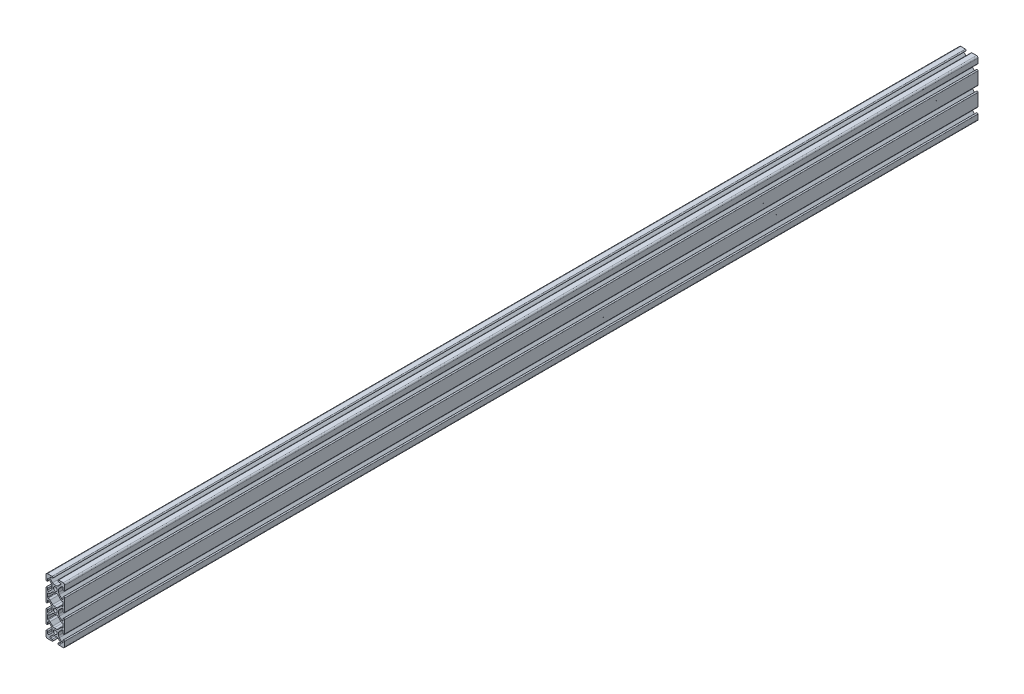
from build123d import *

# Parameters (mm, degrees)
SKETCH1_R      = 2.5
EXTRUDE1_DEPTH = 1219.2


with BuildPart() as part:
    # Sketch1 → Extrude1 (new body)
    with BuildSketch(Plane.XY):
        with BuildLine():
            Line((10.359994631, 56.429997403), (10.359989144, 54.32))
            ThreePointArc((10.359989144, 54.32), (11.429994572, 53.249994572), (12.5, 54.32))
            Line((12.5, 54.32), (12.5, 60.5))
            ThreePointArc((12.5, 60.5), (11.914213562, 61.914213562), (10.5, 62.5))
            Line((10.5, 62.5), (4.32, 62.5))
            ThreePointArc((4.32, 62.5), (3.25, 61.429994572), (4.32, 60.359989144))
            Line((4.32, 60.359989144), (6.429506446, 60.359994631))
            ThreePointArc((6.429506446, 60.359994631), (7.35320663, 59.743115807), (7.139431986, 58.653133278))
            Line((7.139431986, 58.653133278), (3.790027931, 55.303236443))
            ThreePointArc((3.790027931, 55.303236443), (2.761605915, 54.616066821), (1.548499435, 54.374764939))
            Line((1.548499435, 54.374764939), (-1.548499435, 54.374764939))
            ThreePointArc((-1.548499435, 54.374764939), (-2.761605915, 54.616066821), (-3.790027931, 55.303236443))
            Line((-3.790027931, 55.303236443), (-7.138393059, 58.651601571))
            ThreePointArc((-7.138393059, 58.651601571), (-7.354112119, 59.742117633), (-6.429997403, 60.359994631))
            Line((-6.429997403, 60.359994631), (-4.32, 60.359989144))
            ThreePointArc((-4.32, 60.359989144), (-3.25, 61.429994572), (-4.32, 62.5))
            Line((-4.32, 62.5), (-10.5, 62.5))
            ThreePointArc((-10.5, 62.5), (-11.914213562, 61.914213562), (-12.5, 60.5))
            Line((-12.5, 60.5), (-12.5, 54.32))
            ThreePointArc((-12.5, 54.32), (-11.429994572, 53.25), (-10.359989144, 54.32))
            Line((-10.359989144, 54.32), (-10.359994631, 56.429506446))
            ThreePointArc((-10.359994631, 56.429506446), (-9.743115807, 57.35320663), (-8.653133278, 57.139431986))
            Line((-8.653133278, 57.139431986), (-5.303236443, 53.790027931))
            ThreePointArc((-5.303236443, 53.790027931), (-4.616066821, 52.761605915), (-4.374764939, 51.548499435))
            Line((-4.374764939, 51.548499435), (-4.374764939, 48.451500565))
            ThreePointArc((-4.374764939, 48.451500565), (-4.616066821, 47.238394085), (-5.303236443, 46.209972069))
            Line((-5.303236443, 46.209972069), (-8.651601571, 42.861606941))
            ThreePointArc((-8.651601571, 42.861606941), (-9.742117633, 42.645887881), (-10.359994631, 43.570002597))
            Line((-10.359994631, 43.570002597), (-10.359989144, 45.68))
            ThreePointArc((-10.359989144, 45.68), (-11.429994572, 46.75), (-12.5, 45.68))
            Line((-12.5, 45.68), (-12.5, 29.32))
            ThreePointArc((-12.5, 29.32), (-11.429994572, 28.25), (-10.359989144, 29.32))
            Line((-10.359989144, 29.32), (-10.359994631, 31.429506446))
            ThreePointArc((-10.359994631, 31.429506446), (-9.743115807, 32.35320663), (-8.653133278, 32.139431986))
            Line((-8.653133278, 32.139431986), (-5.303236443, 28.790027931))
            ThreePointArc((-5.303236443, 28.790027931), (-4.616066821, 27.761605915), (-4.374764939, 26.548499435))
            Line((-4.374764939, 26.548499435), (-4.374764939, 23.451500565))
            ThreePointArc((-4.374764939, 23.451500565), (-4.616066821, 22.238394085), (-5.303236443, 21.209972069))
            Line((-5.303236443, 21.209972069), (-8.651601571, 17.861606941))
            ThreePointArc((-8.651601571, 17.861606941), (-9.742117633, 17.645887881), (-10.359994631, 18.570002597))
            Line((-10.359994631, 18.570002597), (-10.359989144, 20.68))
            ThreePointArc((-10.359989144, 20.68), (-11.429994572, 21.75), (-12.5, 20.68))
            Line((-12.5, 20.68), (-12.5, 4.32))
            ThreePointArc((-12.5, 4.32), (-11.429994572, 3.25), (-10.359989144, 4.32))
            Line((-10.359989144, 4.32), (-10.359994631, 6.429506446))
            ThreePointArc((-10.359994631, 6.429506446), (-9.743115807, 7.35320663), (-8.653133278, 7.139431986))
            Line((-8.653133278, 7.139431986), (-5.303236443, 3.790027931))
            ThreePointArc((-5.303236443, 3.790027931), (-4.616066821, 2.761605915), (-4.374764939, 1.548499435))
            Line((-4.374764939, 1.548499435), (-4.374764939, -1.548499435))
            ThreePointArc((-4.374764939, -1.548499435), (-4.616066821, -2.761605915), (-5.303236443, -3.790027931))
            Line((-5.303236443, -3.790027931), (-8.651601571, -7.138393059))
            ThreePointArc((-8.651601571, -7.138393059), (-9.742114506, -7.354113415), (-10.359994624, -6.430004173))
            Line((-10.359994624, -6.430004173), (-10.359989144, -4.32))
            ThreePointArc((-10.359989144, -4.32), (-11.429994572, -3.25), (-12.5, -4.32))
            Line((-12.5, -4.32), (-12.5, -10.5))
            ThreePointArc((-12.5, -10.5), (-11.914213562, -11.914213562), (-10.5, -12.5))
            Line((-10.5, -12.5), (-4.32, -12.5))
            ThreePointArc((-4.32, -12.5), (-3.25, -11.429994572), (-4.32, -10.359989144))
            Line((-4.32, -10.359989144), (-6.429506446, -10.359994631))
            ThreePointArc((-6.429506446, -10.359994631), (-7.35320663, -9.743115807), (-7.139431986, -8.653133278))
            Line((-7.139431986, -8.653133278), (-3.790027931, -5.303236443))
            ThreePointArc((-3.790027931, -5.303236443), (-2.761605915, -4.616066821), (-1.548499435, -4.374764939))
            Line((-1.548499435, -4.374764939), (1.548499435, -4.374764939))
            ThreePointArc((1.548499435, -4.374764939), (2.761605915, -4.616066821), (3.790027931, -5.303236443))
            Line((3.790027931, -5.303236443), (7.138393059, -8.651601571))
            ThreePointArc((7.138393059, -8.651601571), (7.354112119, -9.742117633), (6.429997403, -10.359994631))
            Line((6.429997403, -10.359994631), (4.32, -10.359989144))
            ThreePointArc((4.32, -10.359989144), (3.25, -11.429994572), (4.32, -12.5))
            Line((4.32, -12.5), (10.5, -12.5))
            ThreePointArc((10.5, -12.5), (11.914213562, -11.914213562), (12.5, -10.5))
            Line((12.5, -10.5), (12.5, -4.32))
            ThreePointArc((12.5, -4.32), (11.429994572, -3.25), (10.359989144, -4.32))
            Line((10.359989144, -4.32), (10.359994631, -6.429506446))
            ThreePointArc((10.359994631, -6.429506446), (9.743115807, -7.35320663), (8.653133278, -7.139431986))
            Line((8.653133278, -7.139431986), (5.303236443, -3.790027931))
            ThreePointArc((5.303236443, -3.790027931), (4.616066821, -2.761605915), (4.374764939, -1.548499435))
            Line((4.374764939, -1.548499435), (4.374764939, 1.548499435))
            ThreePointArc((4.374764939, 1.548499435), (4.616066821, 2.761605915), (5.303236443, 3.790027931))
            Line((5.303236443, 3.790027931), (8.651601571, 7.138393059))
            ThreePointArc((8.651601571, 7.138393059), (9.742064275, 7.354134242), (10.359994624, 6.430113002))
            Line((10.359994624, 6.430113002), (10.359989144, 4.32))
            ThreePointArc((10.359989144, 4.32), (11.429994572, 3.25), (12.5, 4.32))
            Line((12.5, 4.32), (12.5, 20.68))
            ThreePointArc((12.5, 20.68), (11.429994572, 21.75), (10.359989144, 20.68))
            Line((10.359989144, 20.68), (10.359994631, 18.570493554))
            ThreePointArc((10.359994631, 18.570493554), (9.743115807, 17.64679337), (8.653133278, 17.860568014))
            Line((8.653133278, 17.860568014), (5.303236443, 21.209972069))
            ThreePointArc((5.303236443, 21.209972069), (4.616066821, 22.238394085), (4.374764939, 23.451500565))
            Line((4.374764939, 23.451500565), (4.374764939, 26.548499435))
            ThreePointArc((4.374764939, 26.548499435), (4.616066821, 27.761605915), (5.303236443, 28.790027931))
            Line((5.303236443, 28.790027931), (8.651601571, 32.138393059))
            ThreePointArc((8.651601571, 32.138393059), (9.742117633, 32.354112119), (10.359994631, 31.429997403))
            Line((10.359994631, 31.429997403), (10.359989144, 29.32))
            ThreePointArc((10.359989144, 29.32), (11.429994572, 28.25), (12.5, 29.32))
            Line((12.5, 29.32), (12.5, 45.68))
            ThreePointArc((12.5, 45.68), (11.429994572, 46.75), (10.359989144, 45.68))
            Line((10.359989144, 45.68), (10.359994631, 43.570493554))
            ThreePointArc((10.359994631, 43.570493554), (9.743115807, 42.64679337), (8.653133278, 42.860568014))
            Line((8.653133278, 42.860568014), (5.303236443, 46.209972069))
            ThreePointArc((5.303236443, 46.209972069), (4.616066821, 47.238394085), (4.374764939, 48.451500565))
            Line((4.374764939, 48.451500565), (4.374764939, 51.548499435))
            ThreePointArc((4.374764939, 51.548499435), (4.616066821, 52.761605915), (5.303236443, 53.790027931))
            Line((5.303236443, 53.790027931), (8.651601571, 57.138393059))
            ThreePointArc((8.651601571, 57.138393059), (9.742117633, 57.354112119), (10.359994631, 56.429997403))
        make_face()
        Circle(SKETCH1_R, mode=Mode.SUBTRACT)
        with Locations((0, 25)):
            Circle(SKETCH1_R, mode=Mode.SUBTRACT)
        with Locations((0, 50)):
            Circle(SKETCH1_R, mode=Mode.SUBTRACT)
        with BuildLine():
            Line((9.369848481, 15.43), (9.6, 15.43))
            ThreePointArc((9.6, 15.43), (10.137401154, 15.207401154), (10.36, 14.67))
            Line((10.36, 14.67), (10.36, 10.330489657))
            ThreePointArc((10.36, 10.330489657), (10.137401154, 9.793088504), (9.6, 9.570489657))
            Line((9.6, 9.570489657), (9.369847005, 9.570489657))
            ThreePointArc((9.369847005, 9.570489657), (8.156632812, 9.329143157), (7.128153634, 8.641853267))
            Line((7.128153634, 8.641853267), (3.790027931, 5.303236443))
            ThreePointArc((3.790027931, 5.303236443), (2.761605915, 4.616066821), (1.548499435, 4.374764939))
            Line((1.548499435, 4.374764939), (-1.548499435, 4.374764939))
            ThreePointArc((-1.548499435, 4.374764939), (-2.761605915, 4.616066821), (-3.790027931, 5.303236443))
            Line((-3.790027931, 5.303236443), (-7.128319985, 8.641528496))
            ThreePointArc((-7.128319985, 8.641528496), (-8.156742, 9.328698118), (-9.369848481, 9.57))
            Line((-9.369848481, 9.57), (-9.6, 9.57))
            ThreePointArc((-9.6, 9.57), (-10.137401154, 9.792598846), (-10.36, 10.33))
            Line((-10.36, 10.33), (-10.36, 14.669510343))
            ThreePointArc((-10.36, 14.669510343), (-10.137401154, 15.206911496), (-9.6, 15.429510343))
            Line((-9.6, 15.429510343), (-9.369847005, 15.429510343))
            ThreePointArc((-9.369847005, 15.429510343), (-8.156632812, 15.670856843), (-7.128153634, 16.358146733))
            Line((-7.128153634, 16.358146733), (-3.790027931, 19.696763557))
            ThreePointArc((-3.790027931, 19.696763557), (-2.761605915, 20.383933179), (-1.548499435, 20.625235061))
            Line((-1.548499435, 20.625235061), (1.548499435, 20.625235061))
            ThreePointArc((1.548499435, 20.625235061), (2.761605915, 20.383933179), (3.790027931, 19.696763557))
            Line((3.790027931, 19.696763557), (7.128319985, 16.358471504))
            ThreePointArc((7.128319985, 16.358471504), (8.156742, 15.671301882), (9.369848481, 15.43))
        make_face(mode=Mode.SUBTRACT)
        with BuildLine():
            Line((9.369848481, 40.43), (9.6, 40.43))
            ThreePointArc((9.6, 40.43), (10.137401154, 40.207401154), (10.36, 39.67))
            Line((10.36, 39.67), (10.36, 35.330489657))
            ThreePointArc((10.36, 35.330489657), (10.137401154, 34.793088504), (9.6, 34.570489657))
            Line((9.6, 34.570489657), (9.369847005, 34.570489657))
            ThreePointArc((9.369847005, 34.570489657), (8.156632812, 34.329143157), (7.128153634, 33.641853267))
            Line((7.128153634, 33.641853267), (3.790027931, 30.303236443))
            ThreePointArc((3.790027931, 30.303236443), (2.761605915, 29.616066821), (1.548499435, 29.374764939))
            Line((1.548499435, 29.374764939), (-1.548499435, 29.374764939))
            ThreePointArc((-1.548499435, 29.374764939), (-2.761605915, 29.616066821), (-3.790027931, 30.303236443))
            Line((-3.790027931, 30.303236443), (-7.128319985, 33.641528496))
            ThreePointArc((-7.128319985, 33.641528496), (-8.156742, 34.328698118), (-9.369848481, 34.57))
            Line((-9.369848481, 34.57), (-9.6, 34.57))
            ThreePointArc((-9.6, 34.57), (-10.137401154, 34.792598846), (-10.36, 35.33))
            Line((-10.36, 35.33), (-10.36, 39.669510343))
            ThreePointArc((-10.36, 39.669510343), (-10.137401154, 40.206911496), (-9.6, 40.429510343))
            Line((-9.6, 40.429510343), (-9.369847005, 40.429510343))
            ThreePointArc((-9.369847005, 40.429510343), (-8.156632812, 40.670856843), (-7.128153634, 41.358146733))
            Line((-7.128153634, 41.358146733), (-3.790027931, 44.696763557))
            ThreePointArc((-3.790027931, 44.696763557), (-2.761605915, 45.383933179), (-1.548499435, 45.625235061))
            Line((-1.548499435, 45.625235061), (1.548499435, 45.625235061))
            ThreePointArc((1.548499435, 45.625235061), (2.761605915, 45.383933179), (3.790027931, 44.696763557))
            Line((3.790027931, 44.696763557), (7.128319985, 41.358471504))
            ThreePointArc((7.128319985, 41.358471504), (8.156742, 40.671301882), (9.369848481, 40.43))
        make_face(mode=Mode.SUBTRACT)
    extrude(amount=-EXTRUDE1_DEPTH)


solid = part.part
